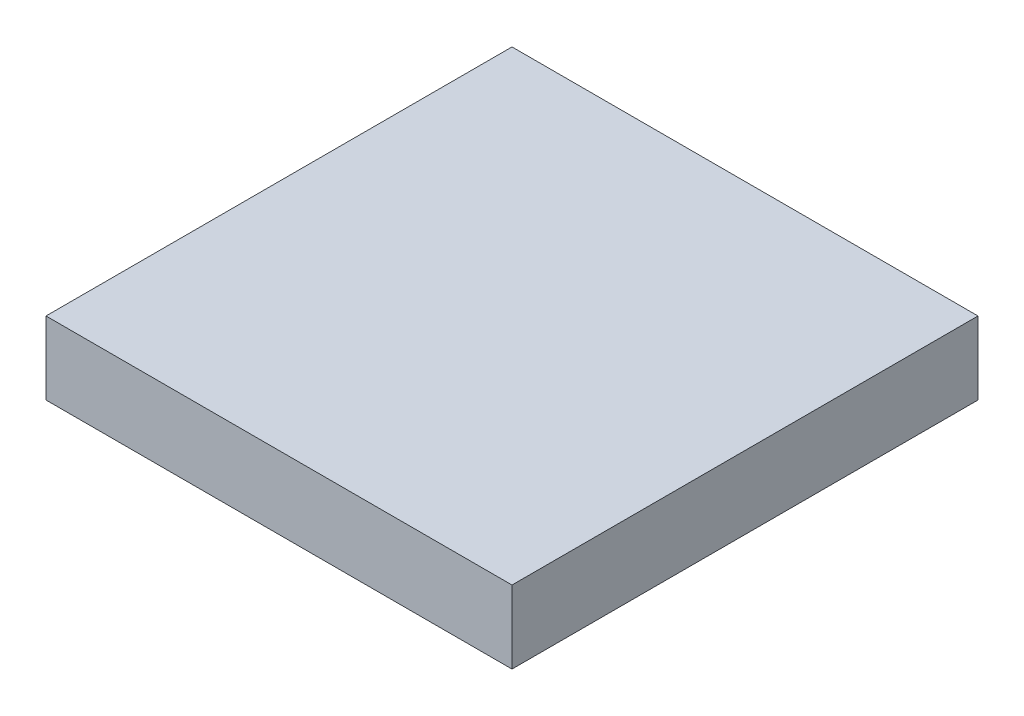
from build123d import *

# Parameters (mm, degrees)
ESBO_O1_W                = 64
ESBO_O1_H                = 64
RESSALTO_EXTRUS_O1_DEPTH = 10


with BuildPart() as part:
    # Esboço1 → Ressalto-extrusão1 (new body)
    with BuildSketch(Plane(origin=(0, 15, 0), x_dir=(1, 0, 0), z_dir=(0, 1, 0))):
        with Locations((0, -32.5)):
            Rectangle(ESBO_O1_W, ESBO_O1_H)
    extrude(amount=RESSALTO_EXTRUS_O1_DEPTH)


solid = part.part
